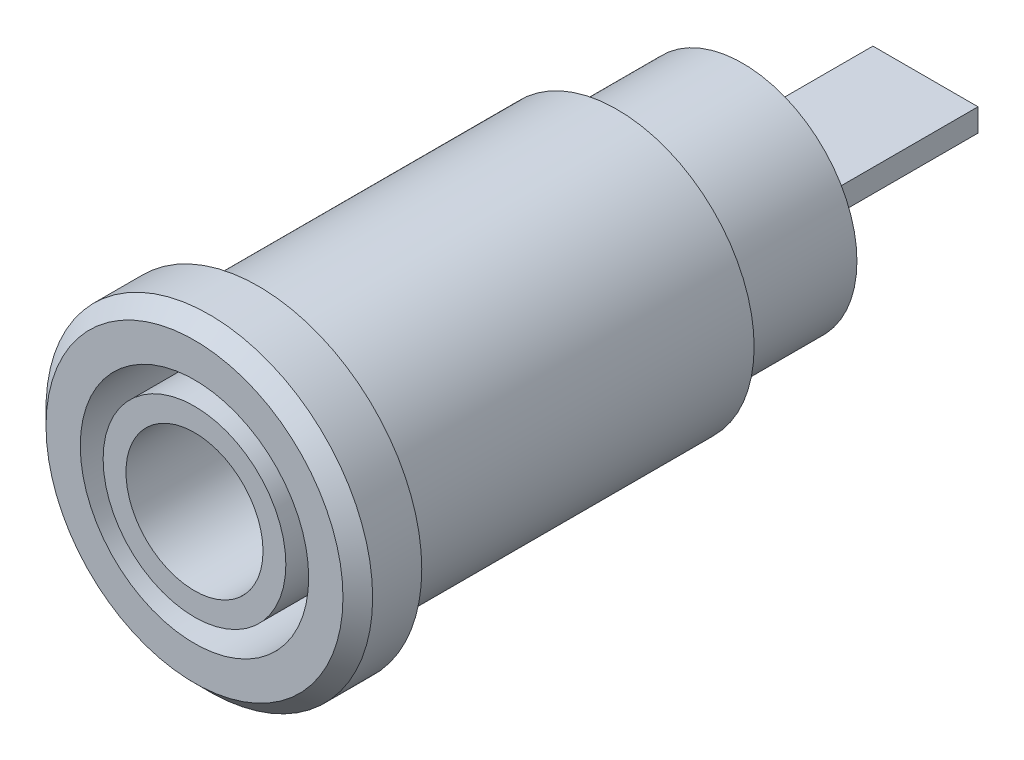
from build123d import *

# Parameters (mm, degrees)
SCHIZZO2_W                   = 4.6
SCHIZZO2_H                   = 1
ESTRUSIONE_ESTRUSIONE1_DEPTH = 8


with BuildPart() as part:
    # Schizzo1 → Rivoluzione1 (revolve)
    with BuildSketch(Plane(origin=(0, 0, 0), x_dir=(0, 0, -1), z_dir=(1, 0, 0)), mode=Mode.PRIVATE) as rivoluzione1_sk:
        Polygon((-17, 6.5), (-16.35, 7.15), (-14.2, 7.15), (-14.2, 6), (1.5, 6), (2, 5), (7, 5), (7, 0), (0, 0), (0, 3), (-17, 3), (-17, 4), (0, 4), (0, 5), (-17, 5), align=None)
    revolve(rivoluzione1_sk.sketch.rotate(Axis((0, 0, 0), (0, 0, -1)), 90), axis=Axis((0, 0, 0), (0, 0, -1)))

    # Schizzo2 → Estrusione-Estrusione1 (add)
    with BuildSketch(Plane(origin=(0, 0, -7), x_dir=(-1, 0, 0), z_dir=(0, 0, -1))):
        Rectangle(SCHIZZO2_W, SCHIZZO2_H)
    extrude(amount=ESTRUSIONE_ESTRUSIONE1_DEPTH)


solid = part.part
